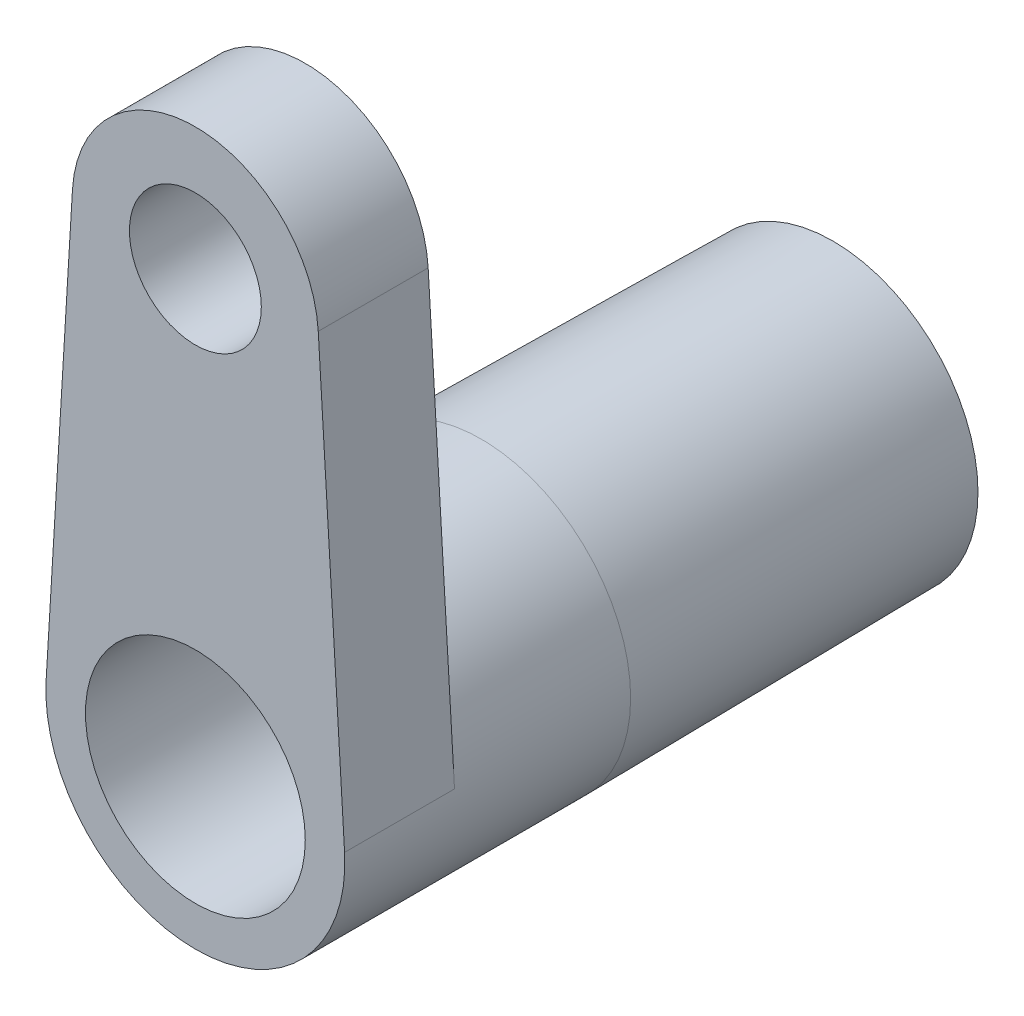
from build123d import *

# Parameters (mm, degrees)
SKETCH1_R           = 3.4
SKETCH1_R_2         = 2.4
BOSS_EXTRUDE1_DEPTH = 3.5
SKETCH2_R           = 3.4
SKETCH2_R_2         = 1.5
BOSS_EXTRUDE2_DEPTH = 8.5
CUT_EXTRUDE1_START  = -6.5
SKETCH3_R           = 2.5
SKETCH3_R_2         = 1.5
CUT_EXTRUDE1_DEPTH  = 6.5
SKETCH4_R           = 1.5
SKETCH4_R_2         = 2.5
BOSS_EXTRUDE3_DEPTH = 2.5
CHAMFER_1_SIZE      = 0.1
CHAMFER_1_SIZE2     = 8


with BuildPart() as part:
    # Sketch1 → Boss-Extrude1 (new body)
    with BuildSketch(Plane.XY):
        Circle(SKETCH1_R)
        Circle(SKETCH1_R_2, mode=Mode.SUBTRACT)
    extrude(amount=BOSS_EXTRUDE1_DEPTH)

    # Sketch2 → Boss-Extrude2 (add)
    with BuildSketch(Plane.XY.offset(3.5)):
        Circle(SKETCH2_R)
        Circle(SKETCH2_R_2, mode=Mode.SUBTRACT)
    extrude(amount=BOSS_EXTRUDE2_DEPTH)

    # Sketch3 → Cut-Extrude1 (cut)
    with BuildSketch(Plane.XY.offset(12).offset(CUT_EXTRUDE1_START)):
        Circle(SKETCH3_R)
        Circle(SKETCH3_R_2, mode=Mode.SUBTRACT)
    extrude(amount=CUT_EXTRUDE1_DEPTH, mode=Mode.SUBTRACT)

    # Sketch4 → Boss-Extrude3 (add)
    with BuildSketch(Plane.XY.offset(12)):
        with BuildLine():
            Line((-2.794955456, 10.168), (-3.393874482, 0.204))
            ThreePointArc((-3.393874482, 0.204), (0, -3.4), (3.393874482, 0.204))
            Line((3.393874482, 0.204), (2.794955456, 10.168))
            ThreePointArc((2.794955456, 10.168), (0, 12.8), (-2.794955456, 10.168))
        make_face()
        with Locations((0, 10)):
            Circle(SKETCH4_R, mode=Mode.SUBTRACT)
        Circle(SKETCH4_R_2, mode=Mode.SUBTRACT)
    extrude(amount=BOSS_EXTRUDE3_DEPTH)

    # 倒角1
    chamfer_1_edges = [part.edges().sort_by_distance(p)[0] for p in [
        (-3.4, 0, 0),
    ]]
    chamfer_1_side = [part.faces().sort_by_distance(p)[0] for p in [
        (-3.303833478, 0, 0),
    ]]
    chamfer(chamfer_1_edges, length=CHAMFER_1_SIZE, length2=CHAMFER_1_SIZE2, reference=chamfer_1_side[0])


solid = part.part
